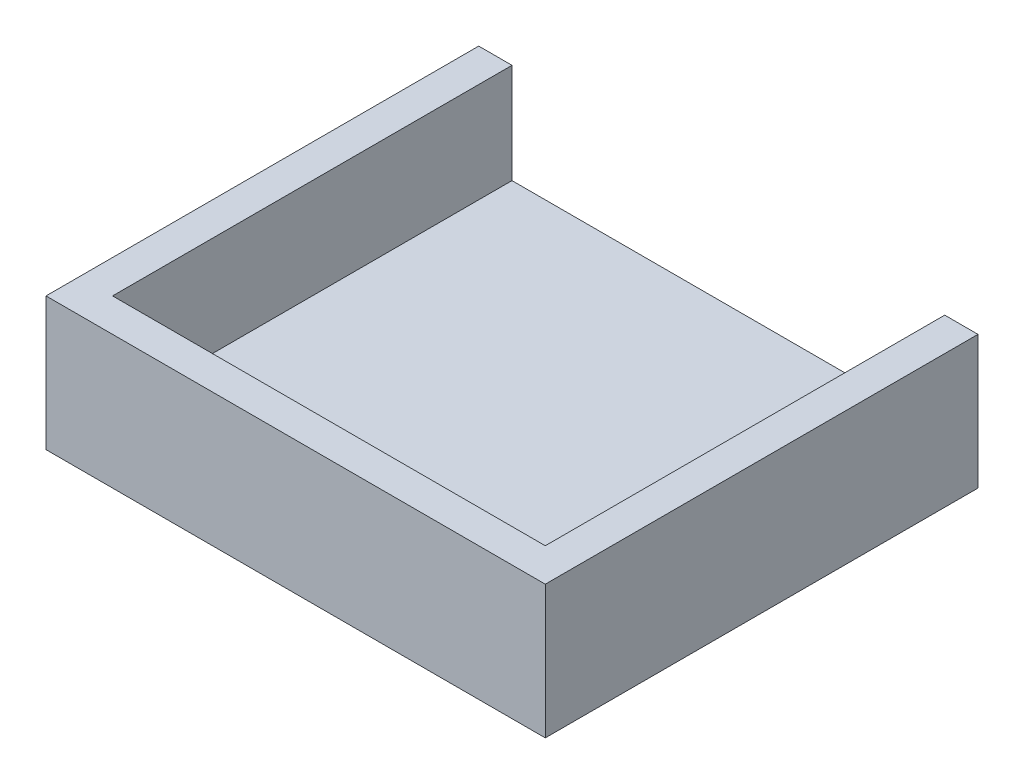
from build123d import *

# Parameters (mm, degrees)
SKETCH_1_W          = 15
SKETCH_1_H          = 13
EXTRUDE_1_DEPTH     = 4
CUT_EXTRUDE_START   = 1
SKETCH_2_W          = 13
SKETCH_2_H          = 15
CUT_EXTRUDE_1_DEPTH = 4
EXTRUDE_START       = 4
SKETCH_3_W          = 15
SKETCH_3_H          = 13
EXTRUDE_3_DEPTH     = 1
CUT_EXTRUDE_START_2 = 5
SKETCH_4_W          = 6
SKETCH_4_H          = 6
CUT_EXTRUDE_2_DEPTH = 1
SKETCH_5_W          = 15
SKETCH_5_H          = 13
CUT_EXTRUDE_3_DEPTH = 1


with BuildPart() as part:
    # 스케치1 → 보스-돌출1 (new body)
    with BuildSketch(Plane(origin=(0, 0, 0), x_dir=(1, 0, 0), z_dir=(0, 1, 0))):
        Rectangle(SKETCH_1_W, SKETCH_1_H)
    extrude(amount=EXTRUDE_1_DEPTH)

    # 스케치2 → 컷-돌출1 (cut)
    with BuildSketch(Plane(origin=(0, 0, 0), x_dir=(1, 0, 0), z_dir=(0, 1, 0)).offset(CUT_EXTRUDE_START)):
        with Locations((0, 2)):
            Rectangle(SKETCH_2_W, SKETCH_2_H)
    extrude(amount=CUT_EXTRUDE_1_DEPTH, mode=Mode.SUBTRACT)


with BuildPart() as body_2:
    # 스케치3 → 보스-돌출3 (new body)
    with BuildSketch(Plane(origin=(0, 0, 0), x_dir=(1, 0, 0), z_dir=(0, 1, 0)).offset(EXTRUDE_START)):
        Rectangle(SKETCH_3_W, SKETCH_3_H)
    extrude(amount=EXTRUDE_3_DEPTH)

    # 스케치4 → 컷-돌출2 (cut)
    with BuildSketch(Plane(origin=(0, 0, 0), x_dir=(1, 0, 0), z_dir=(0, 1, 0)).offset(CUT_EXTRUDE_START_2)):
        with Locations((2.5, -1.5)):
            Rectangle(SKETCH_4_W, SKETCH_4_H)
    extrude(amount=-CUT_EXTRUDE_2_DEPTH, mode=Mode.SUBTRACT)

    # 스케치5 → 컷-돌출3 (cut)
    with BuildSketch(Plane(origin=(0, 5, 0), x_dir=(1, 0, 0), z_dir=(0, 1, 0))):
        Rectangle(SKETCH_5_W, SKETCH_5_H)
    extrude(amount=-CUT_EXTRUDE_3_DEPTH, mode=Mode.SUBTRACT)


solid = part.part
